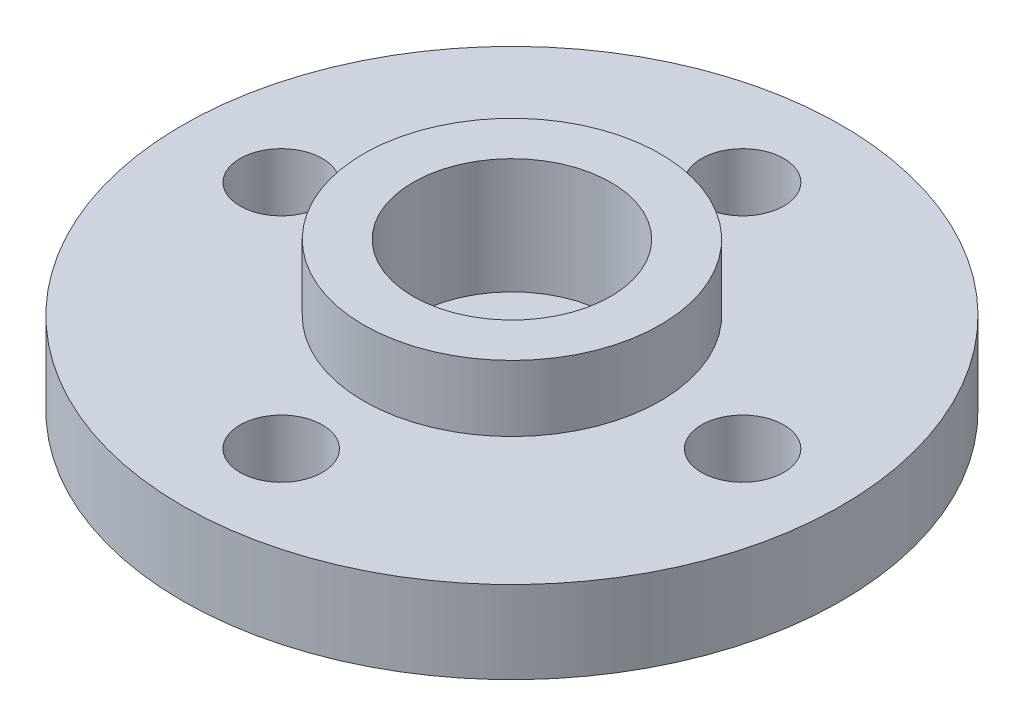
from build123d import *

# Parameters (mm, degrees)
M3_TAPPED_HOLE1_D = 2.5


with BuildPart() as part:
    # Sketch1 → Revolve1 (revolve)
    with BuildSketch(Plane(origin=(0, 0, 0), x_dir=(0, 0, -1), z_dir=(1, 0, 0)), mode=Mode.PRIVATE) as revolve1_sk:
        Polygon((3, 4.5), (3, 1), (1.5, 1), (1.5, 0), (10, 0), (10, 2.5), (4.5, 2.5), (4.5, 4.5), align=None)
    revolve(revolve1_sk.sketch.rotate(Axis((0, 12.525252525, 0), (0, -1, 0)), 180), axis=Axis((0, 12.525252525, 0), (0, -1, 0)))

    # M3 Tapped Hole1 (through all)
    with Locations(Plane(origin=(0, 2.5, 0), x_dir=(1, 0, 0), z_dir=(0, 1, 0))):
        with Locations((0, 7), (7, 0), (0, -7), (-7, 0)):
            Hole(M3_TAPPED_HOLE1_D / 2)


solid = part.part
